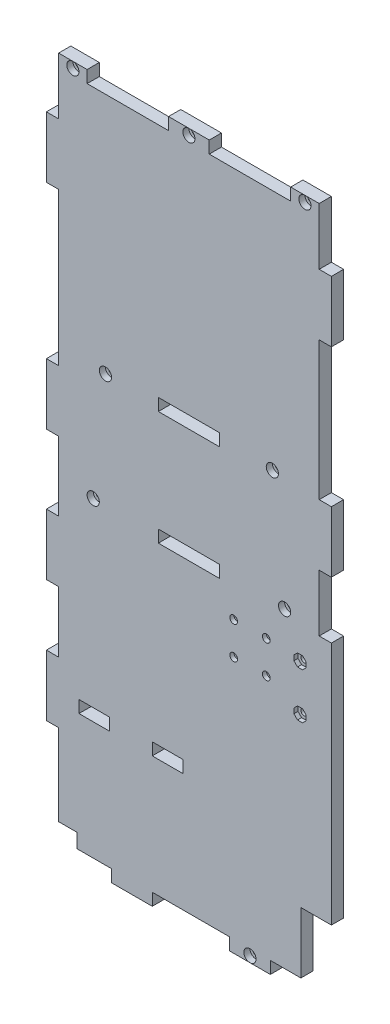
from build123d import *

# Parameters (mm, degrees)
BOSS_EXTRU_1_DEPTH       = 6
ESQUISSE2_R              = 1.5
ESQUISSE2_W              = 30
ESQUISSE2_H              = 6
ENL_V_MAT_EXTRU_1_DEPTH  = 226.720818795
ESQUISSE3_R              = 2.995
ESQUISSE3_R_2            = 3
ENL_V_MAT_EXTRU_2_DEPTH  = 3
ESQUISSE4_R              = 1.005
ENL_V_MAT_EXTRU_4_DEPTH  = 226.720818795
ESQUISSE5_R              = 1.9
ENL_V_MAT_EXTRU_5_DEPTH  = 2
ESQUISSE6_W              = 15
ESQUISSE6_H              = 30
ESQUISSE6_W_2            = 9
ESQUISSE6_H_2            = 7
ENL_V_MAT_EXTRU_6_DEPTH  = 226.720818795
ESQUISSE7_R              = 1.6
ENL_V_MAT_EXTRU_7_DEPTH  = 226.720818795
ESQUISSE10_W             = 15
ESQUISSE10_H             = 6
ENL_V_MAT_EXTRU_9_DEPTH  = 226.720818795
ESQUISSE11_R             = 1.6
ENL_V_MAT_EXTRU_10_DEPTH = 2


with BuildPart() as part:
    # Esquisse1 → Boss.-Extru.1 (new body)
    with BuildSketch(Plane.XY):
        Polygon((-67.628238976, -207.290343107), (-41.628238976, -207.290343107), (-41.628238976, -213.290343107), (-21.628238976, -213.290343107), (-21.628238976, -207.290343107), (16.371761024, -207.290343107), (16.371761024, -213.290343107), (36.371761024, -213.290343107), (36.371761024, -207.290343107), (66.371761024, -207.290343107), (66.371761024, -57.290343107), (60.371761024, -57.290343107), (60.371761024, -29.290343107), (66.371761024, -29.290343107), (66.371761024, 0.709656893), (60.371761024, 0.709656893), (60.371761024, 68.709656893), (66.371761024, 68.709656893), (66.371761024, 98.709656893), (60.371761024, 98.709656893), (60.371761024, 126.709656893), (46.371761024, 126.709656893), (46.371761024, 120.709656893), (6.371761024, 120.709656893), (6.371761024, 126.709656893), (-13.628238976, 126.709656893), (-13.628238976, 120.709656893), (-53.628238976, 120.709656893), (-53.628238976, 126.709656893), (-67.628238976, 126.709656893), (-67.628238976, 98.709656893), (-73.628238976, 98.709656893), (-73.628238976, 68.709656893), (-67.628238976, 68.709656893), (-67.628238976, -6.290343107), (-73.628238976, -6.290343107), (-73.628238976, -36.290343107), (-67.628238976, -36.290343107), (-67.628238976, -70.290343107), (-73.628238976, -70.290343107), (-73.628238976, -100.290343107), (-67.628238976, -100.290343107), (-67.628238976, -130.290343107), (-73.628238976, -130.290343107), (-73.628238976, -160.290343107), (-67.628238976, -160.290343107), align=None)
    extrude(amount=BOSS_EXTRU_1_DEPTH)

    # Esquisse2 → Enlèv. mat.-Extru.1 (cut, through all)
    with BuildSketch(Plane.XY.offset(6)):
        with Locations((-44.628238976, 1.709656893)):
            Circle(ESQUISSE2_R)
        with Locations((37.371761024, 1.709656893)):
            Circle(ESQUISSE2_R)
        with Locations((43.371761024, -54.290343107)):
            Circle(ESQUISSE2_R)
        with Locations((-50.628238976, -54.290343107)):
            Circle(ESQUISSE2_R)
        with Locations((-3.628238976, 123.709656893)):
            Circle(ESQUISSE2_R)
        with Locations((26.371761024, -210.290343107)):
            Circle(ESQUISSE2_R)
        with Locations((-60.628238976, 123.709656893)):
            Circle(ESQUISSE2_R)
        with Locations((53.371761024, 123.709656893)):
            Circle(ESQUISSE2_R)
        with Locations((-3.628238976, 1.709656893)):
            Rectangle(ESQUISSE2_W, ESQUISSE2_H)
        with Locations((-3.628238976, -54.290343107)):
            Rectangle(ESQUISSE2_W, ESQUISSE2_H)
    extrude(amount=-ENL_V_MAT_EXTRU_1_DEPTH, mode=Mode.SUBTRACT)

    # Esquisse3 → Enlèv. mat.-Extru.2 (cut)
    with BuildSketch(Plane.XY.offset(6)):
        with Locations((-3.628238976, 123.709656893)):
            Circle(ESQUISSE3_R)
        with Locations((-60.628238976, 123.709656893)):
            Circle(ESQUISSE3_R)
        with Locations((-44.628238976, 1.709656893)):
            Circle(ESQUISSE3_R_2)
        with Locations((-50.628238976, -54.290343107)):
            Circle(ESQUISSE3_R_2)
        with Locations((26.371761024, -210.290343107)):
            Circle(ESQUISSE3_R)
        with Locations(Location((43.371761024, -54.290343107, 0), (0, 0, 180))):
            Circle(ESQUISSE3_R_2)
        with Locations(Location((37.371761024, 1.709656893, 0), (0, 0, 180))):
            Circle(ESQUISSE3_R_2)
        with Locations(Location((53.371761024, 123.709656893, 0), (0, 0, 180))):
            Circle(ESQUISSE3_R)
    extrude(amount=-ENL_V_MAT_EXTRU_2_DEPTH, mode=Mode.SUBTRACT)

    # Esquisse4 → Enlèv. mat.-Extru.4 (cut, through all)
    with BuildSketch(Plane.XY.offset(6)):
        with Locations((18.361761024, -71.290343107)):
            Circle(ESQUISSE4_R)
        with Locations((34.381761024, -71.290343107)):
            Circle(ESQUISSE4_R)
        with Locations((18.366761024, -87.290343107)):
            Circle(ESQUISSE4_R)
        with Locations((34.376761024, -87.290343107)):
            Circle(ESQUISSE4_R)
    extrude(amount=-ENL_V_MAT_EXTRU_4_DEPTH, mode=Mode.SUBTRACT)

    # Esquisse5 → Enlèv. mat.-Extru.5 (cut)
    with BuildSketch(Plane.XY.offset(6)):
        with Locations((18.361761024, -71.290343107)):
            Circle(ESQUISSE5_R)
        with Locations((34.381761024, -71.290343107)):
            Circle(ESQUISSE5_R)
        with Locations((34.376761024, -87.290343107)):
            Circle(ESQUISSE5_R)
        with Locations((18.366761024, -87.290343107)):
            Circle(ESQUISSE5_R)
    extrude(amount=-ENL_V_MAT_EXTRU_5_DEPTH, mode=Mode.SUBTRACT)

    # Esquisse6 → Enlèv. mat.-Extru.6 (cut, through all)
    with BuildSketch(Plane.XY.offset(6)):
        with Locations((58.871761024, -192.290343107)):
            Rectangle(ESQUISSE6_W, ESQUISSE6_H)
        with Locations((-63.128238976, -203.790343107)):
            Rectangle(ESQUISSE6_W_2, ESQUISSE6_H_2)
    extrude(amount=-ENL_V_MAT_EXTRU_6_DEPTH, mode=Mode.SUBTRACT)

    # Esquisse7 → Enlèv. mat.-Extru.7 (cut, through all)
    with BuildSketch(Plane.XY.offset(6)):
        with Locations((50.971761024, -72.790343107)):
            Circle(ESQUISSE7_R)
        with Locations((50.971761024, -95.342380105)):
            Circle(ESQUISSE7_R)
    extrude(amount=-ENL_V_MAT_EXTRU_7_DEPTH, mode=Mode.SUBTRACT)

    # Esquisse10 → Enlèv. mat.-Extru.9 (cut, through all)
    with BuildSketch(Plane.XY.offset(6)):
        with Locations((-50.128238976, -146.290343107)):
            Rectangle(ESQUISSE10_W, ESQUISSE10_H)
        with Locations((-14.128238976, -146.290343107)):
            Rectangle(ESQUISSE10_W, ESQUISSE10_H)
    extrude(amount=-ENL_V_MAT_EXTRU_9_DEPTH, mode=Mode.SUBTRACT)

    # Esquisse11 → Enlèv. mat.-Extru.10 (cut)
    # profile 1 of 2: a face of its own
    with BuildSketch(Plane.XY.offset(6)):
        Polygon((49.729120337, -69.790343107), (52.214401711, -69.790343107), (53.971761024, -71.54770242), (53.971761024, -74.032983794), (52.214401711, -75.790343107), (49.729120337, -75.790343107), (47.971761024, -74.032983794), (47.971761024, -71.54770242), align=None)
        with Locations((50.971761024, -72.790343107)):
            Circle(ESQUISSE11_R, mode=Mode.SUBTRACT)
    # profile 2 of 2: a face of its own
    with BuildSketch(Plane.XY.offset(6)):
        Polygon((47.971761024, -96.585020792), (49.729120337, -98.342380105), (52.214401711, -98.342380105), (53.971761024, -96.585020792), (53.971761024, -94.099739418), (52.214401711, -92.342380105), (49.729120337, -92.342380105), (47.971761024, -94.099739418), align=None)
        with Locations((50.971761024, -95.342380105)):
            Circle(ESQUISSE11_R, mode=Mode.SUBTRACT)
    extrude(amount=-ENL_V_MAT_EXTRU_10_DEPTH, mode=Mode.SUBTRACT)


solid = part.part
